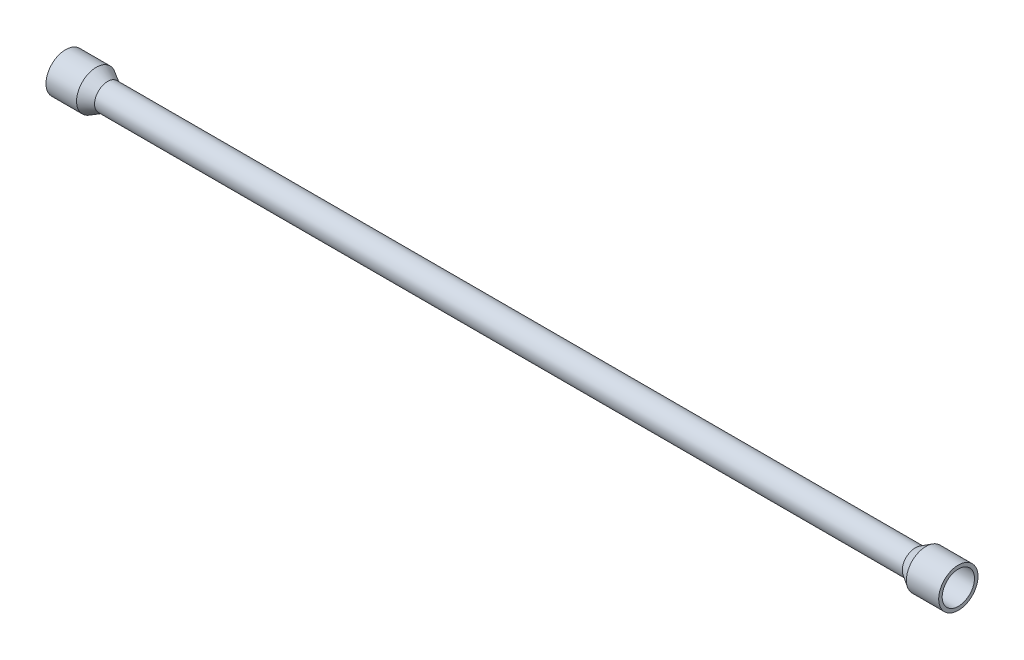
from build123d import *

# Parameters (mm, degrees)
SKETCH1_R           = 75
SKETCH1_R_2         = 37.5
BOSS_EXTRUDE1_DEPTH = 4750
SKETCH2_R           = 112.5
SKETCH2_R_2         = 92.5
BOSS_EXTRUDE2_DEPTH = 185
SKETCH6_R           = 112.5
SKETCH6_R_2         = 87.5
BOSS_EXTRUDE3_DEPTH = 175


with BuildPart() as part:
    # Sketch1 → Boss-Extrude1 (new body)
    with BuildSketch(Plane(origin=(0, 0, 0), x_dir=(0, 0, -1), z_dir=(1, 0, 0))):
        Circle(SKETCH1_R)
        Circle(SKETCH1_R_2, mode=Mode.SUBTRACT)
    extrude(amount=BOSS_EXTRUDE1_DEPTH)



with BuildPart() as body_2:
    # Sketch2 → Boss-Extrude2 (new body)
    with BuildSketch(Plane(origin=(4750, 0, 0), x_dir=(0, 0, -1), z_dir=(1, 0, 0))):
        Circle(SKETCH2_R)
        Circle(SKETCH2_R_2, mode=Mode.SUBTRACT)
    extrude(amount=BOSS_EXTRUDE2_DEPTH)


with BuildPart() as part_1:
    add(part.part)

    add(body_2.part)  # Revolve1 merges body 2
    # Sketch4 → Revolve1 (revolve)
    with BuildSketch(Plane.XY, mode=Mode.PRIVATE) as revolve1_sk:
        Polygon((4750, 112.5), (4688.834916054, 75), (4750, 75), align=None)
    revolve(revolve1_sk.sketch.rotate(Axis((5128.632077333, 0, 0), (-1, 0, 0)), 90), axis=Axis((5128.632077333, 0, 0), (-1, 0, 0)))



with BuildPart() as body_2_2:
    # Sketch6 → Boss-Extrude3 (new body)
    with BuildSketch(Plane.ZY):
        with Locations(Location((0, 0, 0), (0, 0, 180))):
            Circle(SKETCH6_R)
        Circle(SKETCH6_R_2, mode=Mode.SUBTRACT)
    extrude(amount=BOSS_EXTRUDE3_DEPTH)


with BuildPart() as part_2:
    add(part_1.part)

    add(body_2_2.part)  # Revolve2 merges body 2 2
    # Sketch7 → Revolve2 (revolve)
    with BuildSketch(Plane.XY, mode=Mode.PRIVATE) as revolve2_sk:
        Polygon((0, 112.5), (65.363242372, 75), (0, 75), align=None)
    revolve(revolve2_sk.sketch.rotate(Axis((0, 0, 0), (-1, 0, 0)), 270), axis=Axis((0, 0, 0), (-1, 0, 0)))


solid = part_2.part
